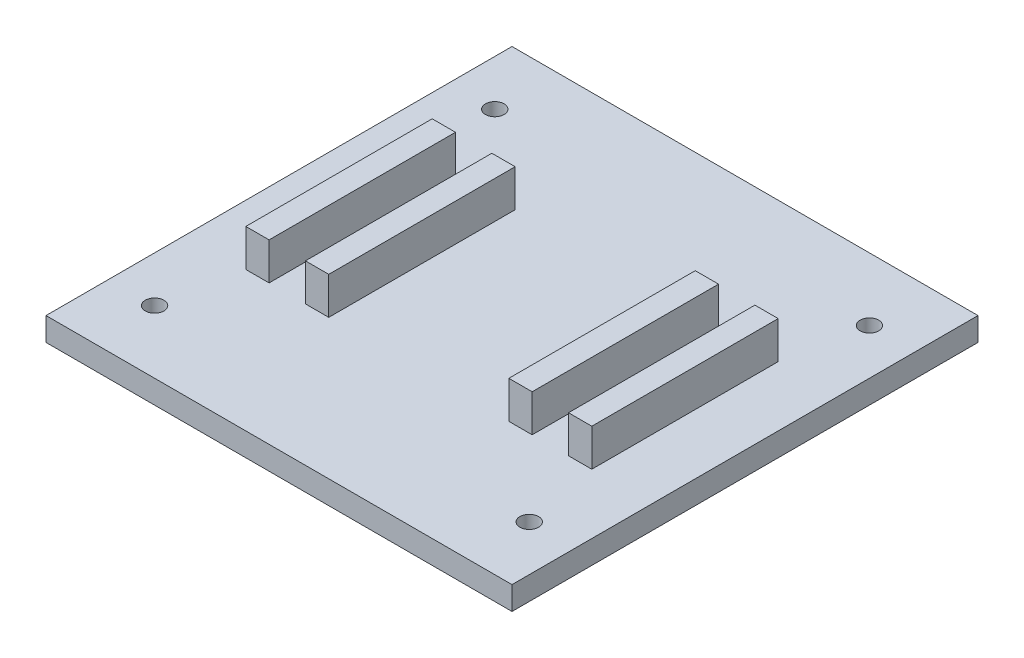
from build123d import *

# Parameters (mm, degrees)
SKETCH1_W           = 100
SKETCH1_H           = 100
BOSS_EXTRUDE1_DEPTH = 5
SKETCH2_W           = 5
SKETCH2_H           = 40
BOSS_EXTRUDE2_DEPTH = 8
SKETCH4_R           = 2
CUT_EXTRUDE1_DEPTH  = 8


with BuildPart() as part:
    # Sketch1 → Boss-Extrude1 (new body)
    with BuildSketch(Plane(origin=(0, 0, 0), x_dir=(1, 0, 0), z_dir=(0, 1, 0))):
        Rectangle(SKETCH1_W, SKETCH1_H)
    extrude(amount=BOSS_EXTRUDE1_DEPTH)

    # Sketch2 → Boss-Extrude2 (add)
    with BuildSketch(Plane(origin=(0, 5, 0), x_dir=(1, 0, 0), z_dir=(0, 1, 0))):
        with Locations((21.825, 0)):
            Rectangle(SKETCH2_W, SKETCH2_H)
        with Locations((-34.625, 0)):
            Rectangle(SKETCH2_W, SKETCH2_H)
        with Locations((-21.825, 0)):
            Rectangle(SKETCH2_W, SKETCH2_H)
        with Locations((34.625, 0)):
            Rectangle(SKETCH2_W, SKETCH2_H)
    extrude(amount=BOSS_EXTRUDE2_DEPTH)

    # Sketch4 → Cut-Extrude1 (cut)
    with BuildSketch(Plane(origin=(0, 5, 0), x_dir=(1, 0, 0), z_dir=(0, 1, 0))):
        with Locations(Location((40.2, 36.5, 0), (0, 0, 270))):
            Circle(SKETCH4_R)
        with Locations(Location((40.2, -36.5, 0), (0, 0, 270))):
            Circle(SKETCH4_R)
        with Locations(Location((-40.2, -36.5, 0), (0, 0, 270))):
            Circle(SKETCH4_R)
        with Locations(Location((-40.2, 36.5, 0), (0, 0, 270))):
            Circle(SKETCH4_R)
    extrude(amount=-CUT_EXTRUDE1_DEPTH, mode=Mode.SUBTRACT)


solid = part.part
